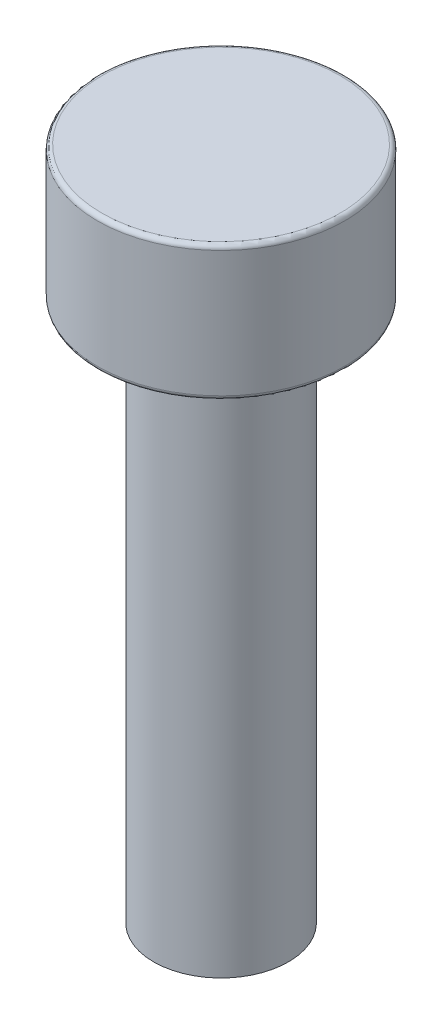
from build123d import *

# Parameters (mm, degrees)
SKETCH1_R           = 1.5
BOSS_EXTRUDE1_DEPTH = 12
SKETCH2_R           = 2.75
BOSS_EXTRUDE2_DEPTH = 3
FILLET1_R           = 0.2
FILLET2_R           = 0.1
FILLET3_R           = 0.1


with BuildPart() as part:
    # Sketch1 → Boss-Extrude1 (new body)
    with BuildSketch(Plane(origin=(0, 0, 0), x_dir=(1, 0, 0), z_dir=(0, 1, 0))):
        with Locations(Location((0, 0, 0), (0, 0, 270))):
            Circle(SKETCH1_R)
    extrude(amount=BOSS_EXTRUDE1_DEPTH)

    # Sketch2 → Boss-Extrude2 (add)
    with BuildSketch(Plane(origin=(0, 12, 0), x_dir=(1, 0, 0), z_dir=(0, 1, 0))):
        with Locations(Location((0, 0, 0), (0, 0, 270))):
            Circle(SKETCH2_R)
    extrude(amount=BOSS_EXTRUDE2_DEPTH)

    # Fillet1
    fillet1_edges = [part.edges().sort_by_distance(p)[0] for p in [
        (0, 12, -1.5),
    ]]
    fillet(fillet1_edges, radius=FILLET1_R)

    # Fillet2
    fillet2_edges = [part.edges().sort_by_distance(p)[0] for p in [
        (0, 15, -2.75),
    ]]
    fillet(fillet2_edges, radius=FILLET2_R)

    # Fillet3
    fillet3_edges = [part.edges().sort_by_distance(p)[0] for p in [
        (0, 12, -2.75),
    ]]
    fillet(fillet3_edges, radius=FILLET3_R)


solid = part.part
